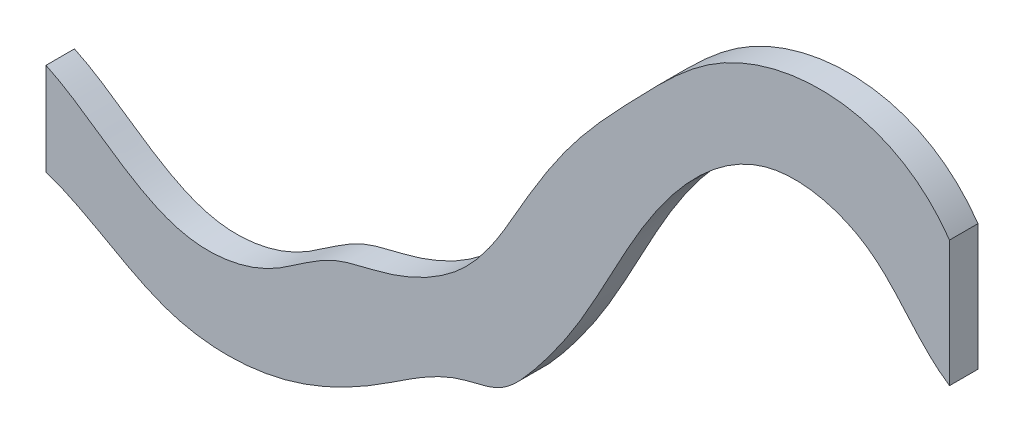
from build123d import *

# Parameters (mm, degrees)
BOSS_EXTRUDE1_DEPTH = 3.15


with BuildPart() as part:
    # Sketch1 → Boss-Extrude1 (new body)
    with BuildSketch(Plane.XY):
        with BuildLine():
            Line((0, 7.874015808), (0, 18.110237122))
            add(Edge.make_bspline(
                [(0, 18.110237122), (5.197250837, 15.681070622), (12.501216503, 7.744855261), (25.097876962, 10.232630048), (30.831117735, 15.646786773), (38.839584006, 16.923397014), (47.530018638, 21.437168604), (52.595075133, 31.301954435), (58.535631865, 40.527401216), (65.917966651, 48.233777596), (77.681512051, 60.27017899), (93.834912938, 60.224267729), (100, 51.360058337)],
                knots=[0, 0, 0, 0, 0.148941706, 0.220351634, 0.287719618, 0.334218391, 0.414248514, 0.515237394, 0.595838964, 0.681768577, 0.77460146, 1, 1, 1, 1], degree=3))
            Line((100, 51.360058337), (100, 37.401573181))
            add(Edge.make_bspline(
                [(0, 7.874015808), (4.944591816, 6.243851617), (10.475763732, 1.560198012), (19.800962139, 0.078437915), (28.045639535, 1.023070952), (36.905378333, 5.624841864), (44.002324621, 10.933951141), (50.422695685, 11.835006862), (54.554582877, 16.369202077), (59.475154106, 23.228178272), (64.143527908, 32.715034775), (70.259683215, 42.449409973), (79.649884648, 50.146347234), (92.682596164, 46.948861272), (96.446080944, 39.713208535), (100, 37.401573181)],
                knots=[0, 0, 0, 0, 0.124881401, 0.163041618, 0.22296914, 0.319802796, 0.398409543, 0.431158174, 0.468929657, 0.538576812, 0.635461275, 0.718983693, 0.816425112, 0.900124054, 1, 1, 1, 1], degree=3))
        make_face()
    extrude(amount=BOSS_EXTRUDE1_DEPTH)


solid = part.part
